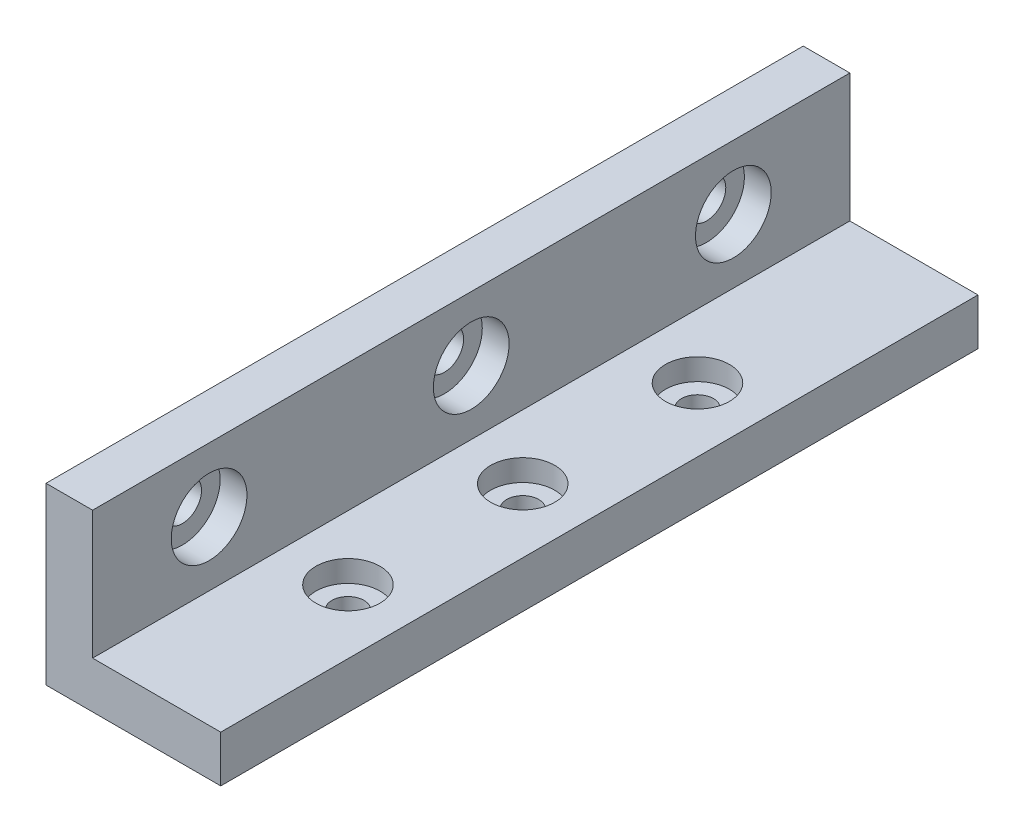
from build123d import *

# Parameters (mm, degrees)
BOSS_EXTRUDE1_DEPTH                      = 130
CBORE_FOR_M5_PAN_HEAD_SCREW1_D           = 5.5
CBORE_FOR_M5_PAN_HEAD_SCREW1_CBORE_D     = 11
CBORE_FOR_M5_PAN_HEAD_SCREW1_CBORE_DEPTH = 3.7
CBORE_FOR_M6_PAN_HEAD_SCREW1_D           = 6.6
CBORE_FOR_M6_PAN_HEAD_SCREW1_CBORE_D     = 13
CBORE_FOR_M6_PAN_HEAD_SCREW1_CBORE_DEPTH = 4.6


with BuildPart() as part:
    # Sketch1 → Boss-Extrude1 (new body)
    with BuildSketch(Plane.XY):
        Polygon((0, 8), (0, 0), (8, 0), (30, 0), (30, 8), (8, 8), (8, 30), (0, 30), align=None)
    extrude(amount=BOSS_EXTRUDE1_DEPTH)

    # CBORE for M5 Pan Head Screw1 (through all)
    with Locations(Plane(origin=(0, 8, 0), x_dir=(1, 0, 0), z_dir=(0, 1, 0))):
        with Locations((19, -67.160533678), (19, -37.160533678), (19, -97.160533678)):
            CounterBoreHole(CBORE_FOR_M5_PAN_HEAD_SCREW1_D / 2, CBORE_FOR_M5_PAN_HEAD_SCREW1_CBORE_D / 2, CBORE_FOR_M5_PAN_HEAD_SCREW1_CBORE_DEPTH)

    # CBORE for M6 Pan Head Screw1 (through all)
    with Locations(Plane(origin=(8, 0, 0), x_dir=(0, 0, -1), z_dir=(1, 0, 0))):
        with Locations((-110, 19), (-65, 19), (-20, 19)):
            CounterBoreHole(CBORE_FOR_M6_PAN_HEAD_SCREW1_D / 2, CBORE_FOR_M6_PAN_HEAD_SCREW1_CBORE_D / 2, CBORE_FOR_M6_PAN_HEAD_SCREW1_CBORE_DEPTH)


solid = part.part
